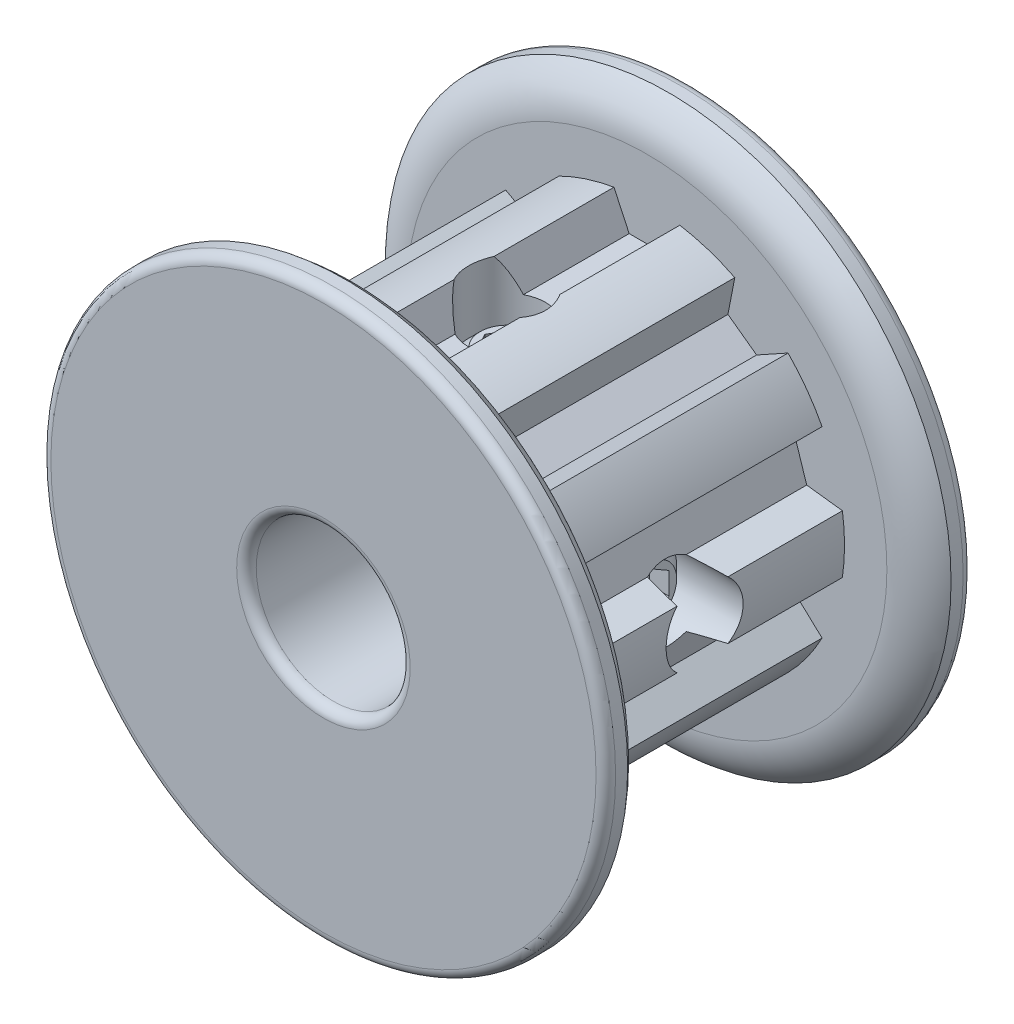
from build123d import *

# Parameters (mm, degrees)
CUT_EXTRUDE1_START = 5.45
CUT_EXTRUDE1_DEPTH = 10.9
CIRPATTERN1_COUNT  = 10
FILLET1_R          = 0.381
SKETCH5_R          = 1.5
CUT_EXTRUDE2_DEPTH = 18.120820722
CUT_EXTRUDE3_DEPTH = 0.75
CIRPATTERN2_COUNT  = 2
CIRPATTERN2_ANGLE  = 270


with BuildPart() as part:
    # Sketch2 → Revolve1 (revolve)
    with BuildSketch(Plane(origin=(0, 0, 0), x_dir=(0, 0, -1), z_dir=(1, 0, 0)), mode=Mode.PRIVATE) as revolve1_sk:
        with BuildLine():
            Line((-7.15, 3), (7.15, 3))
            Line((7.15, 3), (7.15, 11))
            Line((7.15, 11), (6.3, 11))
            ThreePointArc((6.3, 11), (5.67498708, 10.277923433), (5.45, 9.349798153))
            Line((5.45, 9.349798153), (5.45, 7.699596307))
            Line((5.45, 7.699596307), (-5.45, 7.699596307))
            Line((-5.45, 7.699596307), (-5.45, 9.349798153))
            ThreePointArc((-5.45, 9.349798153), (-5.67498708, 10.277923433), (-6.3, 11))
            Line((-6.3, 11), (-7.15, 11))
            Line((-7.15, 11), (-7.15, 3))
        make_face()
    revolve(revolve1_sk.sketch.rotate(Axis((0, 0, 7.15), (0, 0, -1)), 90), axis=Axis((0, 0, 7.15), (0, 0, -1)))

    # Sketch3 → Cut-Extrude1 (cut)
    with BuildSketch(Plane.XY.offset(CUT_EXTRUDE1_START)):
        with BuildLine():
            Line((-0.690489274, 6.322), (0.690489274, 6.322))
            Line((0.690489274, 6.322), (1.2827, 7.592))
            ThreePointArc((1.2827, 7.592), (0, 7.699596307), (-1.2827, 7.592))
            Line((-1.2827, 7.592), (-0.690489274, 6.322))
        make_face()
    cut_extrude1 = extrude(amount=-CUT_EXTRUDE1_DEPTH, mode=Mode.SUBTRACT)

    # CirPattern1: Cut-Extrude1 ×10 about axis
    cirpattern1_axis = Axis((0, 0, 0), (0, 0, 1))
    for i in range(1, CIRPATTERN1_COUNT):
        add(cut_extrude1.rotate(cirpattern1_axis, i * 360 / CIRPATTERN1_COUNT), mode=Mode.SUBTRACT)

    # Fillet1
    fillet1_edges = [part.edges().sort_by_distance(p)[0] for p in [
        (-11, 0, -7.15),
        (-3, 0, -7.15),
        (-3, 0, 7.15),
        (-11, 0, 7.15),
    ]]
    fillet(fillet1_edges, radius=FILLET1_R)

    # Sketch5 → Cut-Extrude2 (cut, through all)
    with BuildSketch(Plane(origin=(0, 0, 0), x_dir=(1, 0, 0), z_dir=(0, 1, 0))):
        with Locations(Location((0, 0, 0), (0, 0, 90))):
            Circle(SKETCH5_R)
    cut_extrude2 = extrude(amount=CUT_EXTRUDE2_DEPTH, mode=Mode.SUBTRACT)

    # Sketch6 → Revolve2 (revolve)
    with BuildSketch(Plane(origin=(0, 0, 0), x_dir=(0, 0, -1), z_dir=(1, 0, 0)), mode=Mode.PRIVATE) as revolve2_sk:
        Polygon((0, 5.56), (0, 3.762), (-1.05, 3.762), (-1.5, 4.212), (-1.5, 5.11), (-1.05, 5.56), align=None)
    revolve2 = revolve(revolve2_sk.sketch.rotate(Axis((0, 5.56, 0), (0, -1, 0)), 180), axis=Axis((0, 5.56, 0), (0, -1, 0)))

    # Sketch7 → Cut-Extrude3 (cut)
    with BuildSketch(Plane(origin=(0, 5.56, 0), x_dir=(1, 0, 0), z_dir=(0, 1, 0))):
        Polygon((0.866025404, 0), (0.433012702, 0.75), (-0.433012702, 0.75), (-0.866025404, 0), (-0.433012702, -0.75), (0.433012702, -0.75), align=None)
    cut_extrude3 = extrude(amount=-CUT_EXTRUDE3_DEPTH, mode=Mode.SUBTRACT)

    # CirPattern2: Cut-Extrude2, Revolve2, Cut-Extrude3 ×2 about axis
    cirpattern2_axis = Axis((0, 0, 0), (0, 0, 1))
    add([cut_extrude2.rotate(cirpattern2_axis, i * CIRPATTERN2_ANGLE / (CIRPATTERN2_COUNT - 1)) for i in range(1, CIRPATTERN2_COUNT)], mode=Mode.SUBTRACT)
    add([revolve2.rotate(cirpattern2_axis, i * CIRPATTERN2_ANGLE / (CIRPATTERN2_COUNT - 1)) for i in range(1, CIRPATTERN2_COUNT)])
    add([cut_extrude3.rotate(cirpattern2_axis, i * CIRPATTERN2_ANGLE / (CIRPATTERN2_COUNT - 1)) for i in range(1, CIRPATTERN2_COUNT)], mode=Mode.SUBTRACT)


solid = part.part
